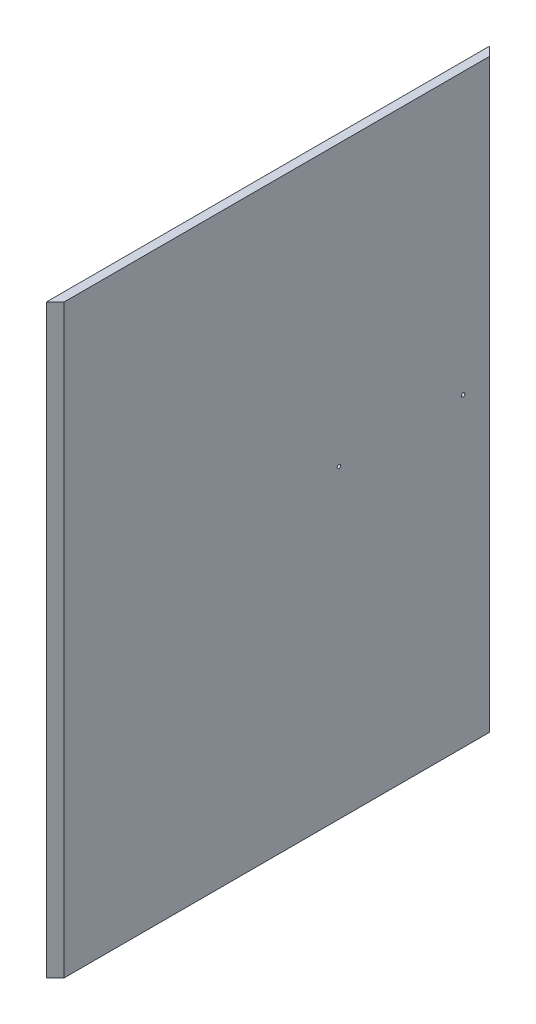
from build123d import *

# Parameters (mm, degrees)
CROQUIS1_W              = 5
CROQUIS1_H              = 250
SALIENTE_EXTRUIR1_DEPTH = 330
CORTAR_EXTRUIR1_REACH   = 416.035
CORTAR_EXTRUIR2_REACH   = 416.035
CROQUIS6_R              = 1


with BuildPart() as part:
    # Croquis1 → Saliente-Extruir1 (new body)
    with BuildSketch(Plane(origin=(0, 0, 0), x_dir=(1, 0, 0), z_dir=(0, 1, 0))):
        with Locations((-2.5, 125)):
            Rectangle(CROQUIS1_W, CROQUIS1_H)
    extrude(amount=SALIENTE_EXTRUIR1_DEPTH)

    # Croquis2 → Cortar-Extruir1 (cut, up to next)
    with BuildSketch(Plane(origin=(0, 330, 0), x_dir=(1, 0, 0), z_dir=(0, 1, 0)), mode=Mode.PRIVATE) as cortar_extruir1_sk1:
        Polygon((0, 250), (0, 245), (-5, 250), align=None)
    cortar_extruir1_tool1 = extrude(cortar_extruir1_sk1.sketch, amount=-CORTAR_EXTRUIR1_REACH, mode=Mode.PRIVATE) & part.part
    # Croquis2 → Cortar-Extruir1 (cut, up to next)
    with BuildSketch(Plane(origin=(0, 330, 0), x_dir=(1, 0, 0), z_dir=(0, 1, 0)), mode=Mode.PRIVATE) as cortar_extruir1_sk2:
        Polygon((-5, 0), (0, 5), (0, 0), align=None)
    cortar_extruir1_tool2 = extrude(cortar_extruir1_sk2.sketch, amount=-CORTAR_EXTRUIR1_REACH, mode=Mode.PRIVATE) & part.part
    add(cortar_extruir1_tool1.solids().sort_by_distance((-1.666667, 330, -248.333333))[0], mode=Mode.SUBTRACT)
    add(cortar_extruir1_tool2.solids().sort_by_distance((-1.666667, 330, -1.666667))[0], mode=Mode.SUBTRACT)

    # Croquis6 → Cortar-Extruir2 (cut, up to next)
    with BuildSketch(Plane.ZY.offset(5), mode=Mode.PRIVATE) as cortar_extruir2_sk1:
        with Locations((-230, 172.2)):
            Circle(CROQUIS6_R)
    cortar_extruir2_tool1 = extrude(cortar_extruir2_sk1.sketch, amount=-CORTAR_EXTRUIR2_REACH, mode=Mode.PRIVATE) & part.part
    # Croquis6 → Cortar-Extruir2 (cut, up to next)
    with BuildSketch(Plane.ZY.offset(5), mode=Mode.PRIVATE) as cortar_extruir2_sk2:
        with Locations((-160, 172.2)):
            Circle(CROQUIS6_R)
    cortar_extruir2_tool2 = extrude(cortar_extruir2_sk2.sketch, amount=-CORTAR_EXTRUIR2_REACH, mode=Mode.PRIVATE) & part.part
    add(cortar_extruir2_tool1.solids().sort_by_distance((-5, 172.2, -230))[0], mode=Mode.SUBTRACT)
    add(cortar_extruir2_tool2.solids().sort_by_distance((-5, 172.2, -160))[0], mode=Mode.SUBTRACT)


solid = part.part
